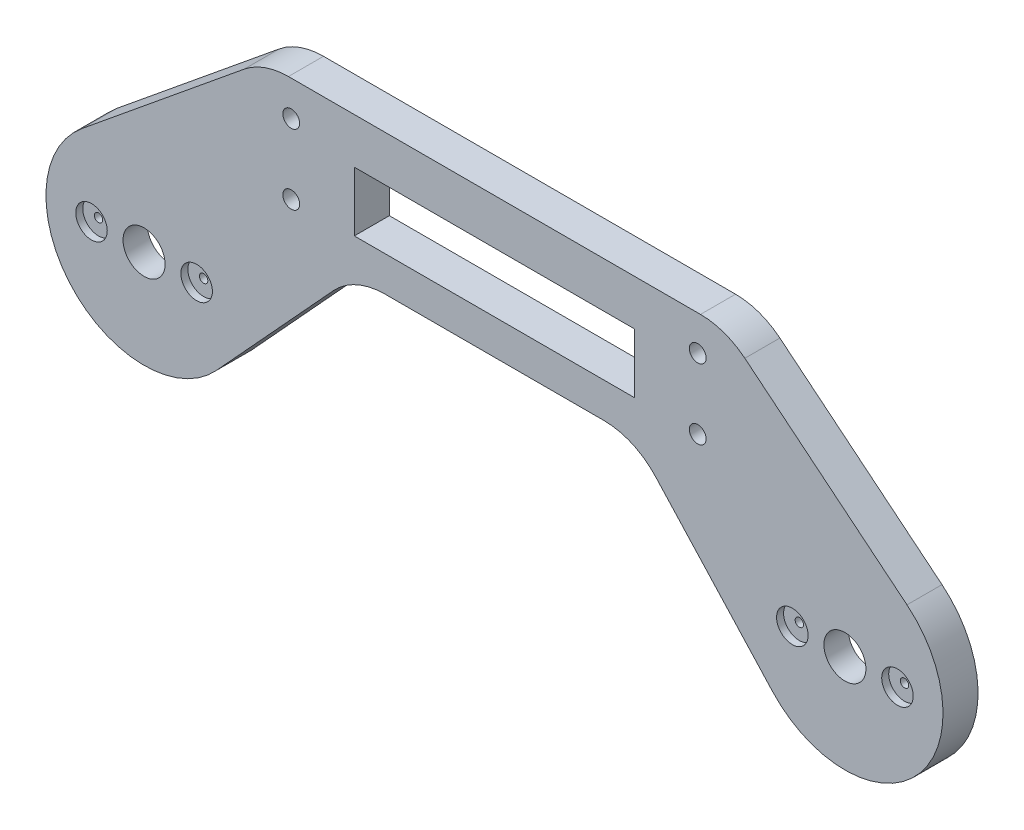
from build123d import *

# Parameters (mm, degrees)
EXTRUDE_1_DEPTH     = 5
SKETCH_4_W          = 40
SKETCH_4_H          = 8.5
CUT_EXTRUDE_1_DEPTH = 5
SKETCH_5_R          = 1.2
CUT_EXTRUDE_2_DEPTH = 7
SKETCH_9_R          = 9
CUT_EXTRUDE_3_DEPTH = 1.5
SKETCH_10_R         = 3
SKETCH_10_R_2       = 0.6
CUT_EXTRUDE_4_DEPTH = 5
SKETCH_11_R         = 2.25
CUT_EXTRUDE_5_DEPTH = 1


with BuildPart() as part:
    # 草图3 → 凸台-拉伸1 (new body)
    with BuildSketch(Plane.XY):
        with BuildLine():
            Line((-35.723215038, 7.743839121), (-58.858024221, -11.158625231))
            ThreePointArc((-58.858024221, -11.158625231), (-60.178030432, -31.612892204), (-39.681768347, -31.462245799))
            Line((-39.681768347, -31.462245799), (-22.972363252, -13.241253001))
            ThreePointArc((-22.972363252, -13.241253001), (-19.627898346, -10.846108205), (-15.602197786, -10))
            Line((-15.602197786, -10), (15.602197786, -10))
            ThreePointArc((15.602197786, -10), (19.627898346, -10.846108205), (22.972363252, -13.241253001))
            Line((22.972363252, -13.241253001), (39.681768347, -31.462245799))
            ThreePointArc((39.681768347, -31.462245799), (60.178030432, -31.612892204), (58.858024221, -11.158625231))
            Line((58.858024221, -11.158625231), (35.723215038, 7.743839121))
            ThreePointArc((35.723215038, 7.743839121), (32.754745755, 9.419086771), (29.39605488, 10))
            Line((29.39605488, 10), (-29.39605488, 10))
            ThreePointArc((-29.39605488, 10), (-32.754745755, 9.419086771), (-35.723215038, 7.743839121))
        make_face()
    extrude(amount=EXTRUDE_1_DEPTH)

    # 草图4 → 切除-拉伸1 (cut)
    with BuildSketch(Plane.XY.offset(5)):
        with Locations((0, -0.75)):
            Rectangle(SKETCH_4_W, SKETCH_4_H)
    extrude(amount=-CUT_EXTRUDE_1_DEPTH, mode=Mode.SUBTRACT)

    # 草图5 → 切除-拉伸2 (cut)
    with BuildSketch(Plane.XY.offset(5)):
        with Locations((-29, -5)):
            Circle(SKETCH_5_R)
        with Locations((-29, 5)):
            Circle(SKETCH_5_R)
    cut_extrude_2 = extrude(amount=-CUT_EXTRUDE_2_DEPTH, mode=Mode.SUBTRACT)

    # 镜向1: 切除-拉伸2 across plane
    add(cut_extrude_2.mirror(Plane.ZY), mode=Mode.SUBTRACT)

    # 草图9 → 切除-拉伸3 (cut)
    with BuildSketch(Plane(origin=(0, 0, 0), x_dir=(-1, 0, 0), z_dir=(0, 0, -1))):
        with Locations((-50, -22)):
            Circle(SKETCH_9_R)
    cut_extrude_3 = extrude(amount=-CUT_EXTRUDE_3_DEPTH, mode=Mode.SUBTRACT)

    # 草图10 → 切除-拉伸4 (cut)
    with BuildSketch(Plane(origin=(0, 0, 1.5), x_dir=(-1, 0, 0), z_dir=(0, 0, -1))):
        with Locations((-50, -22)):
            Circle(SKETCH_10_R)
        with Locations((-57.5, -22)):
            Circle(SKETCH_10_R_2)
        with Locations((-42.5, -22)):
            Circle(SKETCH_10_R_2)
    cut_extrude_4 = extrude(amount=-CUT_EXTRUDE_4_DEPTH, mode=Mode.SUBTRACT)

    # 镜向3: 切除-拉伸3, 切除-拉伸4 across plane
    add(cut_extrude_3.mirror(Plane.ZY), mode=Mode.SUBTRACT)
    add(cut_extrude_4.mirror(Plane.ZY), mode=Mode.SUBTRACT)

    # 草图11 → 切除-拉伸5 (cut)
    with BuildSketch(Plane.XY.offset(5)):
        with Locations((-57.5, -22)):
            Circle(SKETCH_11_R)
        with Locations((-42.5, -22)):
            Circle(SKETCH_11_R)
    cut_extrude_5 = extrude(amount=-CUT_EXTRUDE_5_DEPTH, mode=Mode.SUBTRACT)

    # 镜向4: 切除-拉伸5 across plane
    add(cut_extrude_5.mirror(Plane.ZY), mode=Mode.SUBTRACT)


solid = part.part
